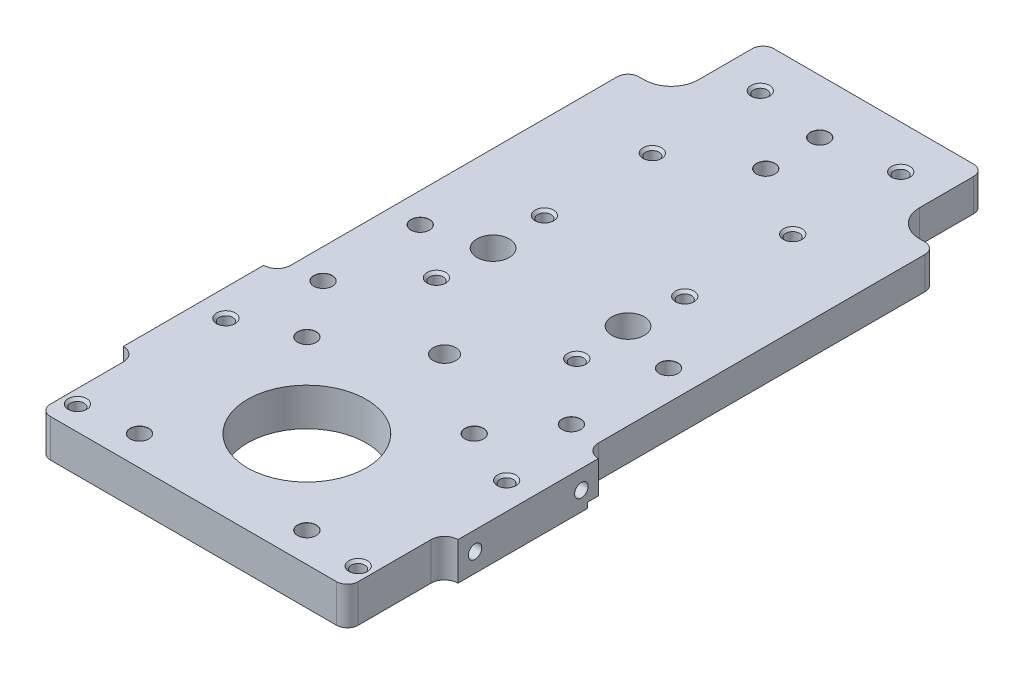
from build123d import *

# Parameters (mm, degrees)
PLATE_MAIN_SKETCH_R                          = 11
PLATE_MAIN_SKETCH_R_2                        = 3
EXTRUDE_PLATE_MAIN_DEPTH                     = 7
CORNER_FILLETS_R                             = 2
M3X0_5_TAPPED_HOLES_AT_2_COUNT               = 2
M3X0_5_TAPPED_HOLES_AT_2_PITCH               = 27.5
M3X0_5_TAPPED_HOLES_AT_3_COUNT               = 2
M3X0_5_TAPPED_HOLES_AT_3_PITCH               = 58.823889705
M3X0_5_TAPPED_HOLES_AT_4_COUNT               = 2
M3X0_5_TAPPED_HOLES_AT_4_PITCH               = 66.206117542
M3X0_5_TAPPED_HOLES_AT_5_COUNT               = 2
M3X0_5_TAPPED_HOLES_AT_5_PITCH               = 83.20606949
M3X0_5_TAPPED_HOLES_AT_6_COUNT               = 2
M3X0_5_TAPPED_HOLES_AT_6_PITCH               = 101.307699609
M3X0_5_TAPPED_HOLES_AT_7_COUNT               = 2
M3X0_5_TAPPED_HOLES_AT_7_PITCH               = 120.013540903
M3X0_5_TAPPED_HOLES_AT_8_COUNT               = 2
M3X0_5_TAPPED_HOLES_AT_8_PITCH               = 114.242067558
M3X0_5_TAPPED_HOLES_AT_9_COUNT               = 2
M3X0_5_TAPPED_HOLES_AT_9_PITCH               = 94.399417371
M3X0_5_TAPPED_HOLES_AT_10_COUNT              = 2
M3X0_5_TAPPED_HOLES_AT_10_PITCH              = 74.640806534
M3X0_5_TAPPED_HOLES_AT_11_COUNT              = 2
M3X0_5_TAPPED_HOLES_AT_11_PITCH              = 55.056788864
M3X0_5_TAPPED_HOLES_AT_12_COUNT              = 2
M3X0_5_TAPPED_HOLES_AT_12_PITCH              = 52
M3_COUNTER_BORES_AT_2_COUNT                  = 2
M3_COUNTER_BORES_AT_2_PITCH                  = 31
M3_COUNTER_BORES_AT_3_COUNT                  = 2
M3_COUNTER_BORES_AT_3_PITCH                  = 43.840620434
M3_COUNTER_BORES_AT_4_COUNT                  = 2
M3_COUNTER_BORES_AT_4_PITCH                  = 31
M3_COUNTER_BORES_AT_5_COUNT                  = 2
M3_COUNTER_BORES_AT_5_PITCH                  = 42.172265768
M3_COUNTER_BORES_AT_6_COUNT                  = 2
M3_COUNTER_BORES_AT_6_PITCH                  = 56.608303278
M3_COUNTER_BORES_AT_7_COUNT                  = 2
M3_COUNTER_BORES_AT_7_PITCH                  = 70.86959856
M3_COUNTER_BORES_AT_8_COUNT                  = 2
M3_COUNTER_BORES_AT_8_PITCH                  = 59.970826241
M3_COUNTER_BORES_AT_9_COUNT                  = 2
M3_COUNTER_BORES_AT_9_PITCH                  = 101.688249075
M3_COUNTER_BORES_AT_10_COUNT                 = 2
M3_COUNTER_BORES_AT_10_PITCH                 = 111.581808553
M5X0_8_TAPPED_HOLE1_D                        = 4.2
CUT_RECESS_DEPTH                             = 1
LEFT_Z_AXIS_SENSORS_M3X0_5_TAPPED_HO_2_COUNT = 2
LEFT_Z_AXIS_SENSORS_M3X0_5_TAPPED_HO_2_PITCH = 19.7


with BuildPart() as part:
    # Plate Main Sketch → Extrude Plate Main (new body)
    with BuildSketch(Plane(origin=(-158.085545862, 0, 24.679095537), x_dir=(-1, 0, 0), z_dir=(0, 1, 0))):
        with BuildLine():
            Line((-178.585545862, -24.679095537), (-137.585545862, -24.679095537))
            Line((-137.585545862, -24.679095537), (-137.585545862, -12.679095537))
            ThreePointArc((-137.585545862, -12.679095537), (-136.121079768, -9.143561631), (-132.585545862, -7.679095537))
            Line((-132.585545862, -7.679095537), (-129.585545862, -7.679095537))
            Line((-129.585545862, -7.679095537), (-129.585545862, 54.820904463))
            ThreePointArc((-129.585545862, 54.820904463), (-128.853312815, 56.588671416), (-127.085545862, 57.320904463))
            Line((-127.085545862, 57.320904463), (-127.085545862, 83.320904463))
            ThreePointArc((-127.085545862, 83.320904463), (-128.853312815, 84.05313751), (-129.585545862, 85.820904463))
            Line((-129.585545862, 85.820904463), (-129.585545862, 101.320904463))
            Line((-129.585545862, 101.320904463), (-186.585545862, 101.320904463))
            Line((-186.585545862, 101.320904463), (-186.585545862, 85.820904463))
            ThreePointArc((-186.585545862, 85.820904463), (-187.317778909, 84.05313751), (-189.085545862, 83.320904463))
            Line((-189.085545862, 83.320904463), (-189.085545862, 57.320904463))
            ThreePointArc((-189.085545862, 57.320904463), (-187.317778909, 56.588671416), (-186.585545862, 54.820904463))
            Line((-186.585545862, 54.820904463), (-186.585545862, -7.679095537))
            Line((-186.585545862, -7.679095537), (-183.585545862, -7.679095537))
            ThreePointArc((-183.585545862, -7.679095537), (-180.050011956, -9.143561631), (-178.585545862, -12.679095537))
            Line((-178.585545862, -12.679095537), (-178.585545862, -24.679095537))
        make_face()
        with Locations(Location((-158.085545862, 80.320904463, 0), (0, 0, 90))):
            Circle(PLATE_MAIN_SKETCH_R, mode=Mode.SUBTRACT)
        with Locations(Location((-145.585545862, 33.320904463, 0), (0, 0, 90))):
            Circle(PLATE_MAIN_SKETCH_R_2, mode=Mode.SUBTRACT)
        with Locations(Location((-170.585545862, 33.320904463, 0), (0, 0, 270))):
            Circle(PLATE_MAIN_SKETCH_R_2, mode=Mode.SUBTRACT)
    extrude(amount=EXTRUDE_PLATE_MAIN_DEPTH)

    # Corner Fillets
    corner_fillets_edges = [part.edges().sort_by_distance(p)[0] for p in [
        (28.5, 3.5, 126),
        (-28.5, 3.5, 126),
        (-28.5, 3.5, 17),
        (-20.5, 3.5, 0),
        (20.5, 3.5, 0),
        (28.5, 3.5, 17),
    ]]
    fillet(corner_fillets_edges, radius=CORNER_FILLETS_R)

    # Sketch13 → M3x0.5 Tapped Holes (revolve, cut)
    with BuildSketch(Plane(origin=(26, 0, 121.5), x_dir=(0, 0, -1), z_dir=(1, 0, 0))):
        Polygon((0, 0), (0, 7), (1.725, 7), (1.25, 6.525), (1.25, 0), align=None)
    m3x0_5_tapped_holes = revolve(axis=Axis((26, -6.35, 121.5), (0, 1, 0)), mode=Mode.SUBTRACT)

    # M3x0.5 Tapped Holes at 2: M3x0.5 Tapped Holes ×2
    with Locations(*[(0, 0, -i * M3X0_5_TAPPED_HOLES_AT_2_PITCH) for i in range(1, M3X0_5_TAPPED_HOLES_AT_2_COUNT)]):
        add(m3x0_5_tapped_holes, mode=Mode.SUBTRACT)

    # M3x0.5 Tapped Holes at 3: M3x0.5 Tapped Holes ×2
    with Locations(*[Vector(-0.8839945855497452, 0, -0.46749713658880765) * (i * M3X0_5_TAPPED_HOLES_AT_3_PITCH) for i in range(1, M3X0_5_TAPPED_HOLES_AT_3_COUNT)]):
        add(m3x0_5_tapped_holes, mode=Mode.SUBTRACT)

    # M3x0.5 Tapped Holes at 4: M3x0.5 Tapped Holes ×2
    with Locations(*[Vector(-0.5890694311623529, 0, -0.8080824247996377) * (i * M3X0_5_TAPPED_HOLES_AT_4_PITCH) for i in range(1, M3X0_5_TAPPED_HOLES_AT_4_COUNT)]):
        add(m3x0_5_tapped_holes, mode=Mode.SUBTRACT)

    # M3x0.5 Tapped Holes at 5: M3x0.5 Tapped Holes ×2
    with Locations(*[Vector(-0.46871580689935055, 0, -0.8833490206949294) * (i * M3X0_5_TAPPED_HOLES_AT_5_PITCH) for i in range(1, M3X0_5_TAPPED_HOLES_AT_5_COUNT)]):
        add(m3x0_5_tapped_holes, mode=Mode.SUBTRACT)

    # M3x0.5 Tapped Holes at 6: M3x0.5 Tapped Holes ×2
    with Locations(*[Vector(-0.38496580369162126, 0, -0.9229308370555532) * (i * M3X0_5_TAPPED_HOLES_AT_6_PITCH) for i in range(1, M3X0_5_TAPPED_HOLES_AT_6_COUNT)]):
        add(m3x0_5_tapped_holes, mode=Mode.SUBTRACT)

    # M3x0.5 Tapped Holes at 7: M3x0.5 Tapped Holes ×2
    with Locations(*[Vector(-0.32496333085967716, 0, -0.9457266167326497) * (i * M3X0_5_TAPPED_HOLES_AT_7_PITCH) for i in range(1, M3X0_5_TAPPED_HOLES_AT_7_COUNT)]):
        add(m3x0_5_tapped_holes, mode=Mode.SUBTRACT)

    # M3x0.5 Tapped Holes at 8: M3x0.5 Tapped Holes ×2
    with Locations(*[Vector(-0.113793458730633, 0, -0.993504428148219) * (i * M3X0_5_TAPPED_HOLES_AT_8_PITCH) for i in range(1, M3X0_5_TAPPED_HOLES_AT_8_COUNT)]):
        add(m3x0_5_tapped_holes, mode=Mode.SUBTRACT)

    # M3x0.5 Tapped Holes at 9: M3x0.5 Tapped Holes ×2
    with Locations(*[Vector(-0.13771271435815216, 0, -0.9904722148067102) * (i * M3X0_5_TAPPED_HOLES_AT_9_PITCH) for i in range(1, M3X0_5_TAPPED_HOLES_AT_9_COUNT)]):
        add(m3x0_5_tapped_holes, mode=Mode.SUBTRACT)

    # M3x0.5 Tapped Holes at 10: M3x0.5 Tapped Holes ×2
    with Locations(*[Vector(-0.17416746420246676, 0, -0.9847160476062541) * (i * M3X0_5_TAPPED_HOLES_AT_10_PITCH) for i in range(1, M3X0_5_TAPPED_HOLES_AT_10_COUNT)]):
        add(m3x0_5_tapped_holes, mode=Mode.SUBTRACT)

    # M3x0.5 Tapped Holes at 11: M3x0.5 Tapped Holes ×2
    with Locations(*[Vector(-0.23611983677697992, 0, -0.9717239436591096) * (i * M3X0_5_TAPPED_HOLES_AT_11_PITCH) for i in range(1, M3X0_5_TAPPED_HOLES_AT_11_COUNT)]):
        add(m3x0_5_tapped_holes, mode=Mode.SUBTRACT)

    # M3x0.5 Tapped Holes at 12: M3x0.5 Tapped Holes ×2
    with Locations(*[(-i * M3X0_5_TAPPED_HOLES_AT_12_PITCH, 0, 0) for i in range(1, M3X0_5_TAPPED_HOLES_AT_12_COUNT)]):
        add(m3x0_5_tapped_holes, mode=Mode.SUBTRACT)

    # Sketch5 → M3 Counter Bores (revolve, cut)
    with BuildSketch(Plane(origin=(-15.5, 0, 120.5), x_dir=(0, 0, -1), z_dir=(1, 0, 0))):
        Polygon((0, 0), (0, 7), (1.725, 7), (1.7, 6.975), (1.7, 4.5), (3, 4.5), (3, 0), align=None)
    m3_counter_bores = revolve(axis=Axis((-15.5, -6.35, 120.5), (0, 1, 0)), mode=Mode.SUBTRACT)

    # M3 Counter Bores at 2: M3 Counter Bores ×2
    with Locations(*[(i * M3_COUNTER_BORES_AT_2_PITCH, 0, 0) for i in range(1, M3_COUNTER_BORES_AT_2_COUNT)]):
        add(m3_counter_bores, mode=Mode.SUBTRACT)

    # M3 Counter Bores at 3: M3 Counter Bores ×2
    with Locations(*[Vector(0.7071067811865479, 0, -0.7071067811865472) * (i * M3_COUNTER_BORES_AT_3_PITCH) for i in range(1, M3_COUNTER_BORES_AT_3_COUNT)]):
        add(m3_counter_bores, mode=Mode.SUBTRACT)

    # M3 Counter Bores at 4: M3 Counter Bores ×2
    with Locations(*[(0, 0, -i * M3_COUNTER_BORES_AT_4_PITCH) for i in range(1, M3_COUNTER_BORES_AT_4_COUNT)]):
        add(m3_counter_bores, mode=Mode.SUBTRACT)

    # M3 Counter Bores at 5: M3 Counter Bores ×2
    with Locations(*[Vector(-0.1778419978967634, 0, -0.9840590550287557) * (i * M3_COUNTER_BORES_AT_5_PITCH) for i in range(1, M3_COUNTER_BORES_AT_5_COUNT)]):
        add(m3_counter_bores, mode=Mode.SUBTRACT)

    # M3 Counter Bores at 6: M3 Counter Bores ×2
    with Locations(*[Vector(0.6801122409730789, 0, -0.7331080000099417) * (i * M3_COUNTER_BORES_AT_6_PITCH) for i in range(1, M3_COUNTER_BORES_AT_6_COUNT)]):
        add(m3_counter_bores, mode=Mode.SUBTRACT)

    # M3 Counter Bores at 7: M3 Counter Bores ×2
    with Locations(*[Vector(0.5432512781572745, 0, -0.8395701571521512) * (i * M3_COUNTER_BORES_AT_7_PITCH) for i in range(1, M3_COUNTER_BORES_AT_7_COUNT)]):
        add(m3_counter_bores, mode=Mode.SUBTRACT)

    # M3 Counter Bores at 8: M3 Counter Bores ×2
    with Locations(*[Vector(-0.12506080823181873, 0, -0.9921490786390946) * (i * M3_COUNTER_BORES_AT_8_PITCH) for i in range(1, M3_COUNTER_BORES_AT_8_COUNT)]):
        add(m3_counter_bores, mode=Mode.SUBTRACT)

    # M3 Counter Bores at 9: M3 Counter Bores ×2
    with Locations(*[Vector(0.15242665834989907, 0, -0.9883147847848291) * (i * M3_COUNTER_BORES_AT_9_PITCH) for i in range(1, M3_COUNTER_BORES_AT_9_COUNT)]):
        add(m3_counter_bores, mode=Mode.SUBTRACT)

    # M3 Counter Bores at 10: M3 Counter Bores ×2
    with Locations(*[Vector(0.13891153227375555, 0, -0.9903047945967733) * (i * M3_COUNTER_BORES_AT_10_PITCH) for i in range(1, M3_COUNTER_BORES_AT_10_COUNT)]):
        add(m3_counter_bores, mode=Mode.SUBTRACT)

    # M5x0.8 Tapped Hole1 (through all)
    with Locations(Plane(origin=(0, 0, 0), x_dir=(-1, 0, 0), z_dir=(0, -1, 0))):
        with Locations((0, -79.5)):
            Hole(M5X0_8_TAPPED_HOLE1_D / 2)

    # Reccess Sketch → Cut Recess (cut)
    with BuildSketch(Plane(origin=(0, 0, 0), x_dir=(1, 0, 0), z_dir=(0, 1, 0))):
        with BuildLine():
            Line((-8.25, 0), (-8.25, -81))
            ThreePointArc((-8.25, -81), (-9.128679656, -83.121320344), (-11.25, -84))
            Line((-11.25, -84), (-31, -84))
            Line((-31, -84), (-31, 0))
            Line((-31, 0), (-8.25, 0))
        make_face()
        with BuildLine():
            Line((31, 0), (8.25, 0))
            Line((8.25, 0), (8.25, -81))
            ThreePointArc((8.25, -81), (9.128679656, -83.121320344), (11.25, -84))
            Line((11.25, -84), (31, -84))
            Line((31, -84), (31, 0))
        make_face()
    extrude(amount=CUT_RECESS_DEPTH, mode=Mode.SUBTRACT)

    # Sketch17 → Left Z-Axis Sensors M3x0.5 Tapped Holes (revolve, cut)
    with BuildSketch(Plane(origin=(-31, 3.5, 85.15), x_dir=(0, 0, 1), z_dir=(0, 1, 0))):
        Polygon((0, 0), (0, 10.751075774), (1.25, 10), (1.25, 0), align=None)
    left_z_axis_sensors_m3x0_5_tapped_holes = revolve(axis=Axis((-37.35, 3.5, 85.15), (1, 0, 0)), mode=Mode.SUBTRACT)

    # Left Z-Axis Sensors M3x0.5 Tapped Ho 2: Left Z-Axis Sensors M3x0.5 Tapped Holes ×2
    with Locations(*[(0, 0, i * LEFT_Z_AXIS_SENSORS_M3X0_5_TAPPED_HO_2_PITCH) for i in range(1, LEFT_Z_AXIS_SENSORS_M3X0_5_TAPPED_HO_2_COUNT)]):
        add(left_z_axis_sensors_m3x0_5_tapped_holes, mode=Mode.SUBTRACT)

    # Right Z-Axis Sensor Holes Mirror: Left Z-Axis Sensors M3x0.5 Tapped Holes across plane
    add(left_z_axis_sensors_m3x0_5_tapped_holes.mirror(Plane(origin=(0, 0, 0), x_dir=(0, 0, 1), z_dir=(1, 0, 0))), mode=Mode.SUBTRACT)

    # Right Z-Axis Sensor Holes Mirror copy 1 → Right Z-Axis Sensor Holes Mirror cop 2 (revolve, cut)
    with BuildSketch(Plane(origin=(31, 3.5, 104.85), x_dir=(0, 0, 1), z_dir=(0, 1, 0))):
        Polygon((0, 0), (0, -10.751075774), (1.25, -10), (1.25, 0), align=None)
    revolve(axis=Axis((37.35, 3.5, 104.85), (1, 0, 0)), mode=Mode.SUBTRACT)


solid = part.part
